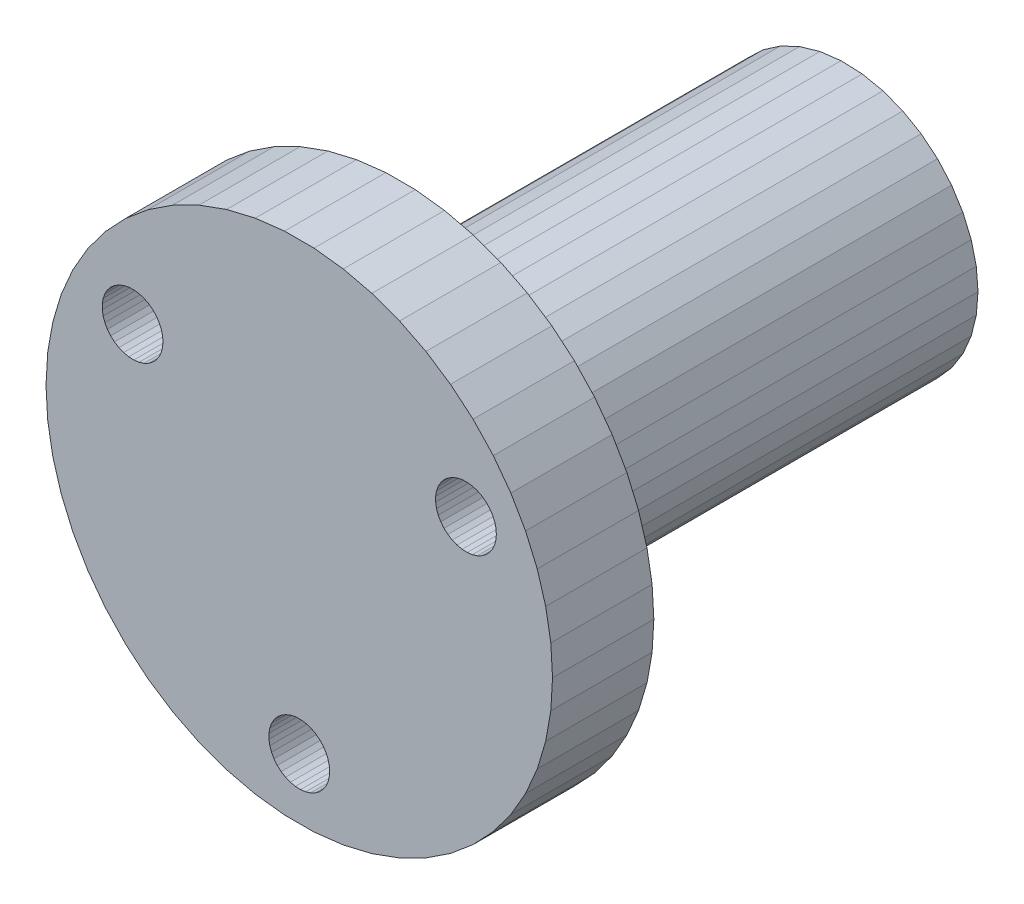
from build123d import *

# Parameters (mm, degrees)
BOSS_EXTRUDE1_DEPTH = 5.00000082
CUT_EXTRUDE1_DEPTH  = 36.692339081
CUT_EXTRUDE2_DEPTH  = 36.692339081
CUT_EXTRUDE3_DEPTH  = 36.692339081
BOSS_EXTRUDE2_DEPTH = 21.999999881
CUT_EXTRUDE4_DEPTH  = 21.999999881


with BuildPart() as part:
    # Sketch1 → Boss-Extrude1 (new body)
    with BuildSketch(Plane(origin=(0, 0, 21.999999881), x_dir=(-1, 0, 0), z_dir=(0, 0, -1))):
        Polygon((-0.33693944, 9.617301635), (-0.084520318, 11.048838496), (0, 12.500000186), (-0.084520318, 13.951160945), (-0.33693944, 15.382697806), (-0.753842294, 16.775252298), (-1.329592429, 18.109988421), (-2.056402154, 19.368862733), (-2.924445085, 20.534845069), (-3.921980038, 21.59217), (-5.035517737, 22.526539862), (-6.250000093, 23.325316608), (-7.549003232, 23.977700621), (-8.914959617, 24.474868551), (-10.329398327, 24.810096249), (-11.77318953, 24.9788519), (-13.226810843, 24.9788519), (-14.670602977, 24.810096249), (-16.085041687, 24.474868551), (-17.450995743, 23.977700621), (-18.750000745, 23.325316608), (-19.964482635, 22.526539862), (-21.078020334, 21.59217), (-22.075556219, 20.534845069), (-22.943597287, 19.368862733), (-23.670408875, 18.109988421), (-24.246158078, 16.775252298), (-24.663060904, 15.382697806), (-24.915479124, 13.951160945), (-25.000000373, 12.500000186), (-24.915479124, 11.048838496), (-24.663060904, 9.617301635), (-24.246158078, 8.224749006), (-23.670408875, 6.890010554), (-22.943597287, 5.631138105), (-22.075556219, 4.465155303), (-21.078020334, 3.407829441), (-19.964482635, 2.47346051), (-18.750000745, 1.674682833), (-17.450995743, 1.02229882), (-16.085041687, 0.52513089), (-14.670602977, 0.189903207), (-13.226810843, 0.021148473), (-11.77318953, 0.021148473), (-10.329398327, 0.189903207), (-8.914959617, 0.52513089), (-7.549003232, 1.02229882), (-6.250000093, 1.674682833), (-5.035517737, 2.47346051), (-3.921980038, 3.407829441), (-2.924445085, 4.465155303), (-2.056402154, 5.631138105), (-1.329592429, 6.890010554), (-0.753842294, 8.224749006), align=None)
    extrude(amount=-BOSS_EXTRUDE1_DEPTH)

    # Sketch2 → Cut-Extrude1 (cut, through all)
    with BuildSketch(Plane(origin=(0, 0, 21.999999881), x_dir=(-1, 0, 0), z_dir=(0, 0, -1))):
        Polygon((-5.751182325, 16.996499151), (-5.687075201, 16.750289127), (-5.582279991, 16.518456861), (-5.439812317, 16.307670623), (-5.26377093, 16.12399146), (-5.059219897, 15.972707421), (-4.832043778, 15.85816592), (-4.588778131, 15.783667564), (-4.336420447, 15.751352534), (-4.082231782, 15.762150288), (-3.833524883, 15.815749764), (-3.597453004, 15.910610557), (-3.380808979, 16.044003889), (-3.189824522, 16.21209085), (-3.029994667, 16.410037875), (-2.905916423, 16.632148996), (-2.821159549, 16.872031614), (-2.778162248, 17.12279208), (-2.778162248, 17.377208918), (-2.821159549, 17.627967522), (-2.905916423, 17.867852002), (-3.029994667, 18.089961261), (-3.189824522, 18.287908286), (-3.380808979, 18.455995247), (-3.597453004, 18.589390442), (-3.833524883, 18.684249371), (-4.082231782, 18.737850711), (-4.336420447, 18.748648465), (-4.588778131, 18.716333434), (-4.832043778, 18.641835079), (-5.059219897, 18.527293578), (-5.26377093, 18.376009539), (-5.439812317, 18.192332238), (-5.582279991, 17.981542274), (-5.687075201, 17.749710009), (-5.751182325, 17.503501847), (-5.772758741, 17.249999568), align=None)
    extrude(amount=-CUT_EXTRUDE1_DEPTH, mode=Mode.SUBTRACT)

    # Sketch3 → Cut-Extrude2 (cut, through all)
    with BuildSketch(Plane(origin=(0, 0, 21.999999881), x_dir=(-1, 0, 0), z_dir=(0, 0, -1))):
        Polygon((-13.667054474, 3.942330368), (-13.809521683, 3.731542267), (-13.914315961, 3.499710001), (-13.978424482, 3.25350184), (-14.000000432, 3.000000492), (-13.978424482, 2.746499144), (-13.914315961, 2.500290051), (-13.809521683, 2.268457785), (-13.667054474, 2.057670616), (-13.491012156, 1.873991452), (-13.286461122, 1.722706482), (-13.059285469, 1.608166844), (-12.816019356, 1.533667557), (-12.563661672, 1.501351595), (-12.309473008, 1.512149349), (-12.060766108, 1.565749757), (-11.824694462, 1.66061148), (-11.608050205, 1.794004813), (-11.417065747, 1.962091774), (-11.257235892, 2.160037868), (-11.133157648, 2.382148057), (-11.048400775, 2.622033469), (-11.005403474, 2.872791141), (-11.005403474, 3.127208911), (-11.048400775, 3.377967514), (-11.133157648, 3.617851995), (-11.257235892, 3.839962184), (-11.417065747, 4.037908278), (-11.608050205, 4.205996171), (-11.824694462, 4.339388572), (-12.060766108, 4.434250295), (-12.309473008, 4.487850703), (-12.563661672, 4.498648457), (-12.816019356, 4.466333427), (-13.059285469, 4.39183414), (-13.286461122, 4.27729357), (-13.491012156, 4.1260086), align=None)
    extrude(amount=-CUT_EXTRUDE2_DEPTH, mode=Mode.SUBTRACT)

    # Sketch4 → Cut-Extrude3 (cut, through all)
    with BuildSketch(Plane.XY.offset(27.0000007)):
        Polygon((19.484477118, 18.089961261), (19.360398874, 17.867852002), (19.275642931, 17.627967522), (19.232645631, 17.377208918), (19.232645631, 17.12279208), (19.275642931, 16.872031614), (19.360398874, 16.632148996), (19.484477118, 16.410037875), (19.644308835, 16.21209085), (19.835293293, 16.044003889), (20.051935688, 15.910610557), (20.288007334, 15.815749764), (20.536715165, 15.762150288), (20.790902898, 15.751352534), (21.04325965, 15.783667564), (21.286528558, 15.85816592), (21.513702348, 15.972707421), (21.718254313, 16.12399146), (21.894294769, 16.307670623), (22.036762908, 16.518456861), (22.141557187, 16.750289127), (22.205665708, 16.996499151), (22.227240726, 17.249999568), (22.205665708, 17.503501847), (22.141557187, 17.749710009), (22.036762908, 17.981542274), (21.894294769, 18.192332238), (21.718254313, 18.376009539), (21.513702348, 18.527293578), (21.286528558, 18.641835079), (21.04325965, 18.716333434), (20.790902898, 18.748648465), (20.536715165, 18.737850711), (20.288007334, 18.684249371), (20.051935688, 18.589390442), (19.835293293, 18.455995247), (19.644308835, 18.287908286), align=None)
    extrude(amount=-CUT_EXTRUDE3_DEPTH, mode=Mode.SUBTRACT)

    # Sketch5 → Boss-Extrude2 (add)
    with BuildSketch(Plane(origin=(0, 0, 21.999999881), x_dir=(-1, 0, 0), z_dir=(0, 0, -1))):
        Polygon((-18.915826455, 11.457326822), (-18.999999389, 12.500000186), (-18.915826455, 13.542673551), (-18.665486947, 14.558342285), (-18.255464733, 15.520700254), (-17.696378753, 16.404824331), (-17.00270921, 17.187817022), (-16.192421317, 17.849395052), (-15.286501497, 18.372429535), (-14.308413491, 18.743367866), (-13.283488341, 18.952608109), (-12.238271534, 18.994728103), (-11.199832894, 18.868638203), (-10.195068084, 18.577605486), (-9.250000119, 18.129166216), (-8.389105089, 17.534933984), (-7.634680253, 16.810296103), (-7.006264757, 15.974028036), (-6.520133931, 15.047783032), (-6.188878324, 14.055551961), (-6.021077745, 13.023032807), (-6.000000052, 12.500000186), (-6.021077745, 11.976967566), (-6.188878324, 10.944448411), (-6.520133931, 9.95221734), (-7.006264757, 9.025972337), (-7.634680253, 8.189703338), (-8.389105089, 7.465067785), (-9.250000119, 6.870835088), (-10.195068084, 6.422394421), (-11.199832894, 6.131361239), (-12.238271534, 6.005271804), (-13.283488341, 6.04739273), (-14.308413491, 6.256632507), (-15.286501497, 6.627572235), (-16.192421317, 7.150604855), (-17.00270921, 7.812184282), (-17.696378753, 8.595176041), (-18.255464733, 9.479299188), (-18.665486947, 10.441658087), align=None)
    extrude(amount=BOSS_EXTRUDE2_DEPTH)

    # Sketch6 → Cut-Extrude4 (cut)
    with BuildSketch(Plane(origin=(0, 0, 0), x_dir=(-1, 0, 0), z_dir=(0, 0, -1))):
        Polygon((-15.323694795, 11.839130893), (-15.169491991, 11.366945691), (-14.936969616, 10.928001255), (-14.632949606, 10.535177775), (-14.266353101, 10.199999437), (-10.733648203, 10.199999437), (-10.367049836, 10.535177775), (-10.063029826, 10.928001255), (-9.830508381, 11.366945691), (-9.676305577, 11.839130893), (-9.604945779, 12.330706231), (-9.618523531, 12.827248313), (-9.716639295, 13.314190321), (-9.896415286, 13.777242973), (-10.152578354, 14.202823862), (-10.477610864, 14.578446746), (-10.861977004, 14.893090352), (-11.294401251, 15.137523413), (-11.762195267, 15.304575674), (-12.251636945, 15.389345586), (-12.748363428, 15.389345586), (-13.237804174, 15.304575674), (-13.705600053, 15.137523413), (-14.138023369, 14.893090352), (-14.52239044, 14.578446746), (-14.84742295, 14.202823862), (-15.103584155, 13.777242973), (-15.283360146, 13.314190321), (-15.381477773, 12.827248313), (-15.395054594, 12.330706231), align=None)
    extrude(amount=-CUT_EXTRUDE4_DEPTH, mode=Mode.SUBTRACT)


solid = part.part
